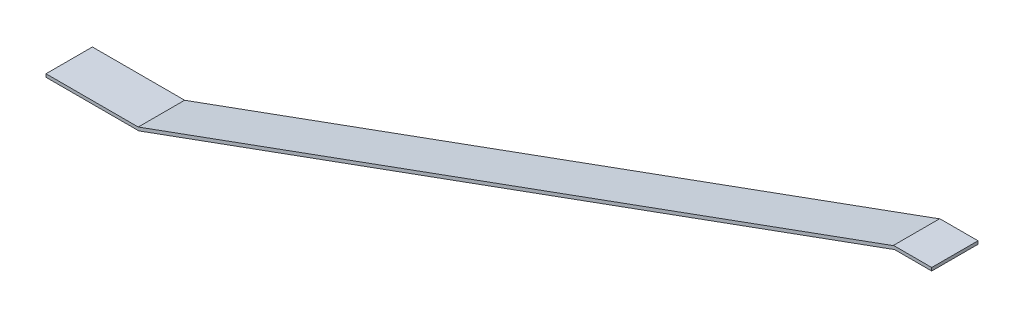
from build123d import *

# Parameters (mm, degrees)
SKETCH2_W                       = 30
SKETCH2_H                       = 15
BOSS_EXTRUDE1_DEPTH             = 1
SKETCH4_W                       = 14.98037952
SKETCH4_H                       = 260
BOSS_EXTRUDE2_DEPTH             = 1
SKETCH6_W                       = 14.958437981
SKETCH6_H                       = 1
BOSS_EXTRUDE3_DEPTH             = 12
BOSS_EXTRUDE3_DIRECTION_2_REACH = 291.054


with BuildPart() as part:
    # Sketch2 → Boss-Extrude1 (new body)
    with BuildSketch(Plane(origin=(0, 0, 0), x_dir=(1, 0, 0), z_dir=(0, 1, 0))):
        with Locations((15, 7.5)):
            Rectangle(SKETCH2_W, SKETCH2_H)
    extrude(amount=BOSS_EXTRUDE1_DEPTH)

    # Sketch4 → Boss-Extrude2 (add)
    with BuildSketch(Plane(origin=(3.509333353, -9.641814145, 0), x_dir=(0, 0, -1), z_dir=(0.34202014332566616, -0.9396926207859094, 0))):
        with Locations((7.49018976, 158.190778624)):
            Rectangle(SKETCH4_W, SKETCH4_H)
    extrude(amount=-BOSS_EXTRUDE2_DEPTH)

    # Sketch6 → Boss-Extrude3 (add)
    with BuildSketch(Plane(origin=(274.320081404, 0, 0), x_dir=(0, 0, 1), z_dir=(1, 0, 0))):
        with Locations((-7.479218991, -89.425237265)):
            Rectangle(SKETCH6_W, SKETCH6_H)
    extrude(amount=BOSS_EXTRUDE3_DEPTH)

    # Boss-Extrude3 direction 2: up to this face of the body (flat: up to its plane)
    boss_extrude3_direction_2_end = Plane(part.part.faces().sort_by_distance((274.149071333, 89.395083575, -7.49018976))[0])
    # Sketch6 → Boss-Extrude3 direction 2 (add, up to the picked face)
    with BuildSketch(Plane(origin=(274.320081404, 0, 0), x_dir=(0, 0, 1), z_dir=(1, 0, 0)), mode=Mode.PRIVATE) as boss_extrude3_direction_2_sk1:
        with Locations((-7.479218991, -89.425237265)):
            Rectangle(SKETCH6_W, SKETCH6_H)
    boss_extrude3_direction_2_tool1 = split(extrude(boss_extrude3_direction_2_sk1.sketch, amount=-BOSS_EXTRUDE3_DIRECTION_2_REACH, mode=Mode.PRIVATE), bisect_by=boss_extrude3_direction_2_end, keep=Keep.BOTH, mode=Mode.PRIVATE)
    add(boss_extrude3_direction_2_tool1.solids().sort_by(Axis((274.320081, 89.425237, -7.479219), (-1, 0, 0)))[0])


solid = part.part
